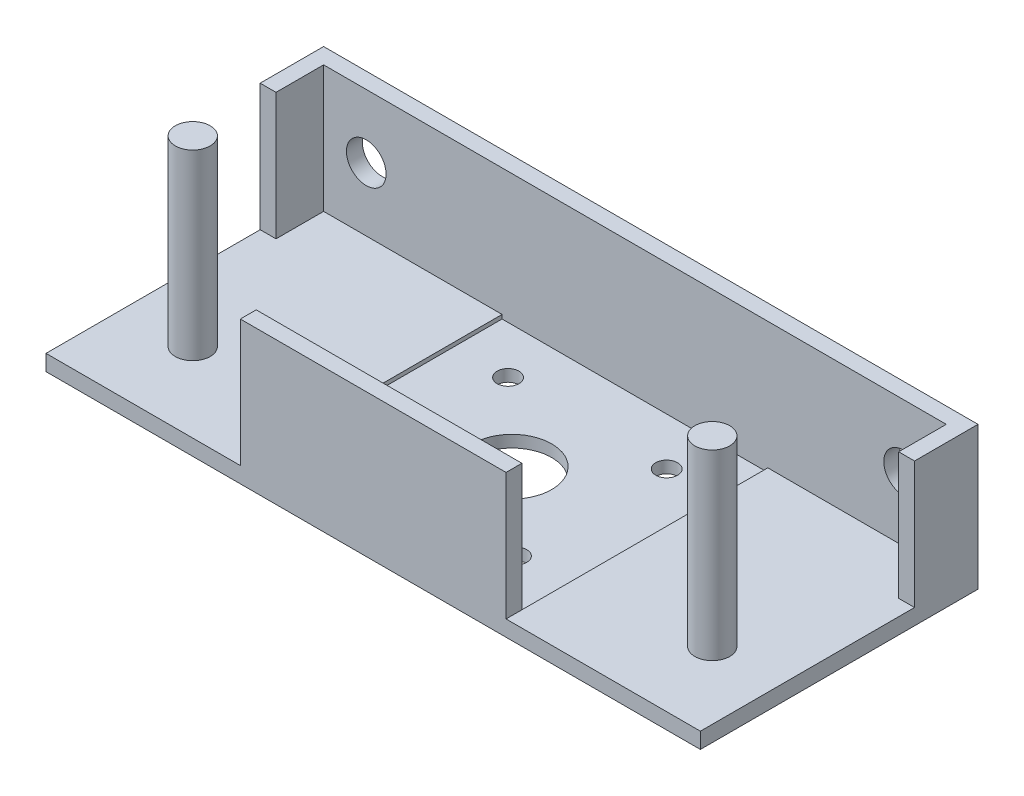
from build123d import *

# Parameters (mm, degrees)
SKETCH1_W                 = 75
SKETCH1_H                 = 40
SKETCH1_R                 = 5
SKETCH1_R_2               = 1.7
SKETCH1_W_2               = 10
SKETCH1_H_2               = 20
BOSS_EXTRUDE1_DEPTH       = 3
CUT_EXTRUDE1_DEPTH        = 43.605750786
CUT_EXTRUDE1_DEPTH_BACK   = 43.605750786
SKETCH2_W                 = 67
SKETCH2_H                 = 28
BOSS_EXTRUDE3_DEPTH       = 110
BOSS_EXTRUDE3_DEPTH_BACK  = 3
SKETCH6_W                 = 67
SKETCH6_H                 = 11
CUT_EXTRUDE4_DEPTH        = 122.372360939
SKETCH7_W                 = 70
SKETCH7_H                 = 37
BOSS_EXTRUDE4_DEPTH       = 45
SKETCH8_W                 = 45
SKETCH8_H                 = 62
CUT_EXTRUDE6_DEPTH        = 29
SKETCH11_W                = 45
SKETCH11_H                = 4
CUT_EXTRUDE9_DEPTH        = 157.445677473
SKETCH9_W                 = 38
SKETCH9_H                 = 28.5
CUT_EXTRUDE10_DEPTH       = 204.024629048
SKETCH13_W                = 5
SKETCH13_H                = 38
BOSS_EXTRUDE5_DEPTH       = 32
SKETCH14_R                = 5
SKETCH14_R_2              = 1.7
CUT_EXTRUDE11_DEPTH       = 32
SKETCH15_W                = 165
SKETCH15_H                = 70
SKETCH15_W_2              = 157
SKETCH15_H_2              = 62
BOSS_EXTRUDE6_DEPTH       = 3
SKETCH16_W                = 20
SKETCH16_H                = 4.820648258
CUT_EXTRUDE12_DEPTH       = 159.626132778
SKETCH18_R                = 5
CUT_EXTRUDE14_DEPTH       = 159.626132778
MIRROR6_COPY_1_SKETCH_W   = 5
MIRROR6_COPY_1_SKETCH_H   = 38
MIRROR6_COPY_1_DEPTH      = 32
MIRROR6_COPY_2_SKETCH_R   = 5
MIRROR6_COPY_2_SKETCH_R_2 = 1.7
MIRROR6_COPY_2_DEPTH      = 32
SKETCH19_W                = 38
SKETCH19_H                = 3.5
CUT_EXTRUDE15_DEPTH       = 10
SKETCH20_R                = 1.2
CUT_EXTRUDE16_DEPTH       = 10
SKETCH21_W                = 10
SKETCH21_H                = 80
CUT_EXTRUDE17_DEPTH       = 184.330984833
SKETCH22_W                = 55
SKETCH22_H                = 80
CUT_EXTRUDE18_DEPTH       = 184.330984833
SKETCH23_W                = 67
SKETCH23_H                = 62
BOSS_EXTRUDE7_DEPTH       = 3
SKETCH24_R                = 10
SKETCH24_R_2              = 2.75
CUT_EXTRUDE19_DEPTH       = 111.707949127
SKETCH25_W                = 38
SKETCH25_H                = 64
CUT_EXTRUDE20_DEPTH       = 115
SKETCH26_W                = 49
SKETCH26_H                = 35
CUT_EXTRUDE21_DEPTH       = 32
SKETCH27_R                = 4.4
BOSS_EXTRUDE8_DEPTH       = 46


with BuildPart() as part:
    # Sketch1 → Boss-Extrude1 (new body)
    with BuildSketch(Plane(origin=(0, 0, 0), x_dir=(1, 0, 0), z_dir=(0, 1, 0))):
        Rectangle(SKETCH1_W, SKETCH1_H)
        with Locations(Location((-21, 0, 0), (0, 0, 270))):
            Circle(SKETCH1_R, mode=Mode.SUBTRACT)
        with Locations(Location((-30, 8.25, 0), (0, 0, 270))):
            Circle(SKETCH1_R_2, mode=Mode.SUBTRACT)
        with Locations(Location((-12, 8.25, 0), (0, 0, 270))):
            Circle(SKETCH1_R_2, mode=Mode.SUBTRACT)
        with Locations(Location((-12, -8.25, 0), (0, 0, 270))):
            Circle(SKETCH1_R_2, mode=Mode.SUBTRACT)
        with Locations(Location((-30, -8.25, 0), (0, 0, 270))):
            Circle(SKETCH1_R_2, mode=Mode.SUBTRACT)
        with Locations(Location((12, 8.25, 0), (0, 0, 90))):
            Circle(SKETCH1_R_2, mode=Mode.SUBTRACT)
        with Locations(Location((12, -8.25, 0), (0, 0, 90))):
            Circle(SKETCH1_R_2, mode=Mode.SUBTRACT)
        with Locations(Location((21, 0, 0), (0, 0, 90))):
            Circle(SKETCH1_R, mode=Mode.SUBTRACT)
        with Locations(Location((30, -8.25, 0), (0, 0, 90))):
            Circle(SKETCH1_R_2, mode=Mode.SUBTRACT)
        with Locations(Location((30, 8.25, 0), (0, 0, 90))):
            Circle(SKETCH1_R_2, mode=Mode.SUBTRACT)
        Rectangle(SKETCH1_W_2, SKETCH1_H_2, mode=Mode.SUBTRACT)
    extrude(amount=BOSS_EXTRUDE1_DEPTH)

    # Sketch2 → Cut-Extrude1 (cut, two sides: drawn at the far end of the back side and taken through both)
    with BuildSketch(Plane(origin=(0, 3, 0), x_dir=(1, 0, 0), z_dir=(0, 1, 0)).offset(-CUT_EXTRUDE1_DEPTH_BACK)):
        Rectangle(SKETCH2_W, SKETCH2_H)
    extrude(amount=CUT_EXTRUDE1_DEPTH + CUT_EXTRUDE1_DEPTH_BACK, mode=Mode.SUBTRACT)

    # Sketch3 → Boss-Extrude3 (add, two sides: drawn at the far end of the back side and taken through both)
    with BuildSketch(Plane(origin=(0, 3, 0), x_dir=(1, 0, 0), z_dir=(0, 1, 0)).offset(-BOSS_EXTRUDE3_DEPTH_BACK)):
        Polygon((37.5, -35), (37.5, -20), (33.5, -20), (-33.5, -20), (-37.5, -20), (-37.5, -35), align=None)
        Polygon((33.5, 20), (37.5, 20), (37.5, 35), (-37.5, 35), (-37.5, 20), (-33.5, 20), align=None)
        Polygon((37.5, -20), (37.5, 20), (33.5, 20), (33.5, 14), (33.5, -14), (33.5, -20), align=None)
        Polygon((-33.5, 14), (-33.5, 20), (-37.5, 20), (-37.5, -20), (-33.5, -20), (-33.5, -14), align=None)
    extrude(amount=BOSS_EXTRUDE3_DEPTH + BOSS_EXTRUDE3_DEPTH_BACK)

    # Sketch6 → Cut-Extrude4 (cut, through all)
    with BuildSketch(Plane(origin=(0, 3, 0), x_dir=(1, 0, 0), z_dir=(0, 1, 0))):
        with Locations((0, -25.5)):
            Rectangle(SKETCH6_W, SKETCH6_H)
        with Locations((0, 25.5)):
            Rectangle(SKETCH6_W, SKETCH6_H)
    extrude(amount=CUT_EXTRUDE4_DEPTH, mode=Mode.SUBTRACT)

    # Sketch7 → Boss-Extrude4 (add)
    with BuildSketch(Plane.ZY.offset(37.5)):
        with Locations((0, 94.5)):
            Rectangle(SKETCH7_W, SKETCH7_H)
    boss_extrude4 = extrude(amount=BOSS_EXTRUDE4_DEPTH)

    # Mirror2: Boss-Extrude4 across plane
    add(boss_extrude4.mirror(Plane(origin=(0, 0, 0), x_dir=(0, 0, 1), z_dir=(1, 0, 0))))

    # Sketch8 → Cut-Extrude6 (cut)
    with BuildSketch(Plane(origin=(0, 113, 0), x_dir=(1, 0, 0), z_dir=(0, 1, 0))):
        with Locations((-56, 0)):
            Rectangle(SKETCH8_W, SKETCH8_H)
        with Locations((56, 0)):
            Rectangle(SKETCH8_W, SKETCH8_H)
    extrude(amount=-CUT_EXTRUDE6_DEPTH, mode=Mode.SUBTRACT)

    # Sketch11 → Cut-Extrude9 (cut, through all)
    with BuildSketch(Plane.XY.offset(35)):
        with Locations((-60, 78)):
            Rectangle(SKETCH11_W, SKETCH11_H)
        with Locations((60, 78)):
            Rectangle(SKETCH11_W, SKETCH11_H)
    extrude(amount=-CUT_EXTRUDE9_DEPTH, mode=Mode.SUBTRACT)

    # Sketch9 → Cut-Extrude10 (cut, through all)
    with BuildSketch(Plane.ZY.offset(82.5)):
        with Locations((0, 98.25)):
            Rectangle(SKETCH9_W, SKETCH9_H)
    extrude(amount=-CUT_EXTRUDE10_DEPTH, mode=Mode.SUBTRACT)

    # Sketch13 → Boss-Extrude5 (add)
    with BuildSketch(Plane(origin=(0, 84, 0), x_dir=(1, 0, 0), z_dir=(0, 1, 0))):
        with Locations((-54.5, 0)):
            Rectangle(SKETCH13_W, SKETCH13_H)
    boss_extrude5 = extrude(amount=BOSS_EXTRUDE5_DEPTH)

    # Sketch14 → Cut-Extrude11 (cut)
    with BuildSketch(Plane.ZY.offset(57)):
        with Locations((0, 98.25)):
            Circle(SKETCH14_R)
        with Locations((-9, 106.5)):
            Circle(SKETCH14_R_2)
        with Locations((9, 106.5)):
            Circle(SKETCH14_R_2)
        with Locations((9, 90)):
            Circle(SKETCH14_R_2)
        with Locations((-9, 90)):
            Circle(SKETCH14_R_2)
    cut_extrude11 = extrude(amount=-CUT_EXTRUDE11_DEPTH, mode=Mode.SUBTRACT)

    # Mirror4: Boss-Extrude5, Cut-Extrude11 across plane
    add(boss_extrude5.mirror(Plane(origin=(0, 0, 0), x_dir=(0, 0, 1), z_dir=(1, 0, 0))))
    add(cut_extrude11.mirror(Plane(origin=(0, 0, 0), x_dir=(0, 0, 1), z_dir=(1, 0, 0))), mode=Mode.SUBTRACT)

    # Sketch15 → Boss-Extrude6 (add)
    with BuildSketch(Plane(origin=(0, 113, 0), x_dir=(1, 0, 0), z_dir=(0, 1, 0))):
        Rectangle(SKETCH15_W, SKETCH15_H)
        Rectangle(SKETCH15_W_2, SKETCH15_H_2, mode=Mode.SUBTRACT)
    extrude(amount=BOSS_EXTRUDE6_DEPTH)

    # Sketch16 → Cut-Extrude12 (cut, through all)
    with BuildSketch(Plane.XY.offset(35)):
        with Locations((0, 11.636111214)):
            Rectangle(SKETCH16_W, SKETCH16_H)
    extrude(amount=-CUT_EXTRUDE12_DEPTH, mode=Mode.SUBTRACT)

    # Sketch18 → Cut-Extrude14 (cut, through all)
    with BuildSketch(Plane.XY.offset(35)):
        with Locations((67.75, 100)):
            Circle(SKETCH18_R)
    cut_extrude14 = extrude(amount=-CUT_EXTRUDE14_DEPTH, mode=Mode.SUBTRACT)

    # Mirror5: Cut-Extrude14 across plane
    add(cut_extrude14.mirror(Plane(origin=(0, 0, 0), x_dir=(0, 0, 1), z_dir=(1, 0, 0))), mode=Mode.SUBTRACT)

    # Mirror6: Boss-Extrude5, Cut-Extrude11 across plane
    add(boss_extrude5.mirror(Plane.ZX.offset(116)))
    add(cut_extrude11.mirror(Plane.ZX.offset(116)), mode=Mode.SUBTRACT)

    # Mirror6 copy 1 sketch → Mirror6 copy 1 (add)
    with BuildSketch(Plane(origin=(0, 148, 0), x_dir=(-1, 0, 0), z_dir=(0, -1, 0))):
        with Locations((-54.5, 0)):
            Rectangle(MIRROR6_COPY_1_SKETCH_W, MIRROR6_COPY_1_SKETCH_H)
    extrude(amount=MIRROR6_COPY_1_DEPTH)

    # Mirror6 copy 2 sketch → Mirror6 copy 2 (cut)
    with BuildSketch(Plane(origin=(57, 232, 0), x_dir=(0, 0, 1), z_dir=(1, 0, 0))):
        with Locations((0, 98.25)):
            Circle(MIRROR6_COPY_2_SKETCH_R)
        with Locations((-9, 106.5)):
            Circle(MIRROR6_COPY_2_SKETCH_R_2)
        with Locations((9, 106.5)):
            Circle(MIRROR6_COPY_2_SKETCH_R_2)
        with Locations((9, 90)):
            Circle(MIRROR6_COPY_2_SKETCH_R_2)
        with Locations((-9, 90)):
            Circle(MIRROR6_COPY_2_SKETCH_R_2)
    extrude(amount=-MIRROR6_COPY_2_DEPTH, mode=Mode.SUBTRACT)

    # Sketch19 → Cut-Extrude15 (cut)
    with BuildSketch(Plane(origin=(82.5, 0, 0), x_dir=(0, 0, -1), z_dir=(1, 0, 0))):
        with Locations((0, 114.25)):
            Rectangle(SKETCH19_W, SKETCH19_H)
    cut_extrude15 = extrude(amount=-CUT_EXTRUDE15_DEPTH, mode=Mode.SUBTRACT)

    # Mirror7: Cut-Extrude15 across plane
    add(cut_extrude15.mirror(Plane(origin=(0, 0, 0), x_dir=(0, 0, 1), z_dir=(1, 0, 0))), mode=Mode.SUBTRACT)

    # Sketch20 → Cut-Extrude16 (cut)
    with BuildSketch(Plane(origin=(0, 3, 0), x_dir=(1, 0, 0), z_dir=(0, 1, 0))):
        with Locations(Location((-24, 17.5, 0), (0, 0, 270))):
            Circle(SKETCH20_R)
        with Locations(Location((-12, 17.5, 0), (0, 0, 270))):
            Circle(SKETCH20_R)
        with Locations(Location((12, 17.5, 0), (0, 0, 270))):
            Circle(SKETCH20_R)
        with Locations(Location((-24, -17.5, 0), (0, 0, 270))):
            Circle(SKETCH20_R)
        with Locations(Location((-12, -17.5, 0), (0, 0, 270))):
            Circle(SKETCH20_R)
        with Locations(Location((24, 17.5, 0), (0, 0, 270))):
            Circle(SKETCH20_R)
        with Locations(Location((12, -17.5, 0), (0, 0, 270))):
            Circle(SKETCH20_R)
        with Locations(Location((24, -17.5, 0), (0, 0, 270))):
            Circle(SKETCH20_R)
    extrude(amount=-CUT_EXTRUDE16_DEPTH, mode=Mode.SUBTRACT)

    # Sketch21 → Cut-Extrude17 (cut, through all)
    with BuildSketch(Plane.XY.offset(35)):
        with Locations((32.5, 40)):
            Rectangle(SKETCH21_W, SKETCH21_H)
        with Locations((-32.5, 40)):
            Rectangle(SKETCH21_W, SKETCH21_H)
    extrude(amount=-CUT_EXTRUDE17_DEPTH, mode=Mode.SUBTRACT)

    # Sketch22 → Cut-Extrude18 (cut, through all)
    with BuildSketch(Plane.XY.offset(35)):
        with Locations((0, 40)):
            Rectangle(SKETCH22_W, SKETCH22_H)
    extrude(amount=-CUT_EXTRUDE18_DEPTH, mode=Mode.SUBTRACT)

    # Sketch23 → Boss-Extrude7 (add)
    with BuildSketch(Plane.XZ.offset(-80)):
        Rectangle(SKETCH23_W, SKETCH23_H)
    extrude(amount=-BOSS_EXTRUDE7_DEPTH)

    # Sketch24 → Cut-Extrude19 (cut, through all)
    with BuildSketch(Plane(origin=(0, 83, 0), x_dir=(1, 0, 0), z_dir=(0, 1, 0))):
        with Locations(Location((0, 0, 0), (0, 0, 270))):
            Circle(SKETCH24_R)
        with Locations(Location((-20, 19, 0), (0, 0, 270))):
            Circle(SKETCH24_R_2)
        with Locations(Location((-20, -19, 0), (0, 0, 270))):
            Circle(SKETCH24_R_2)
        with Locations(Location((20, -19, 0), (0, 0, 90))):
            Circle(SKETCH24_R_2)
        with Locations(Location((20, 19, 0), (0, 0, 90))):
            Circle(SKETCH24_R_2)
    extrude(amount=-CUT_EXTRUDE19_DEPTH, mode=Mode.SUBTRACT)

    # Sketch25 → Cut-Extrude20 (cut)
    with BuildSketch(Plane(origin=(57, 0, 0), x_dir=(0, 0, -1), z_dir=(1, 0, 0))):
        with Locations((0, 116)):
            Rectangle(SKETCH25_W, SKETCH25_H)
    extrude(amount=-CUT_EXTRUDE20_DEPTH, mode=Mode.SUBTRACT)

    # Sketch26 → Cut-Extrude21 (cut)
    with BuildSketch(Plane(origin=(0, 116, 0), x_dir=(1, 0, 0), z_dir=(0, 1, 0))):
        with Locations((58, -17.5)):
            Rectangle(SKETCH26_W, SKETCH26_H)
    cut_extrude21 = extrude(amount=-CUT_EXTRUDE21_DEPTH, mode=Mode.SUBTRACT)

    # Mirror8: Cut-Extrude21 across plane
    add(cut_extrude21.mirror(Plane(origin=(0, 0, 0), x_dir=(0, 0, 1), z_dir=(1, 0, 0))), mode=Mode.SUBTRACT)

    # Sketch27 → Boss-Extrude8 (add)
    with BuildSketch(Plane(origin=(0, 84, 0), x_dir=(1, 0, 0), z_dir=(0, 1, 0))):
        with Locations(Location((65.5, -15, 0), (0, 0, 90))):
            Circle(SKETCH27_R)
    boss_extrude8 = extrude(amount=BOSS_EXTRUDE8_DEPTH)

    # Mirror9: Boss-Extrude8 across plane
    add(boss_extrude8.mirror(Plane(origin=(0, 0, 0), x_dir=(0, 0, 1), z_dir=(1, 0, 0))))


solid = part.part
